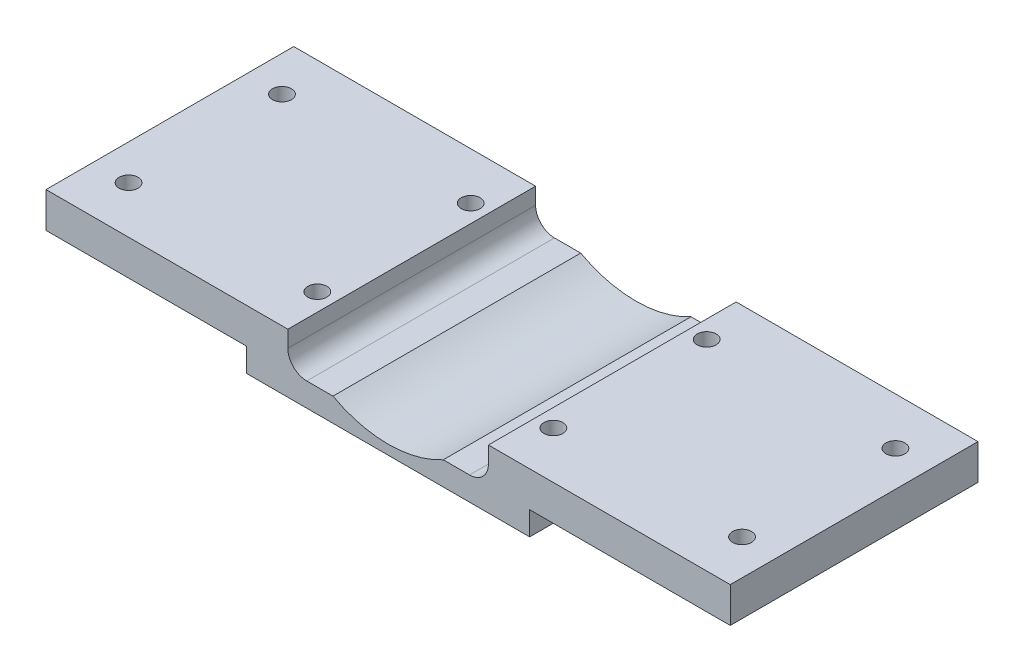
from build123d import *

# Parameters (mm, degrees)
SKETCH1_W              = 184.15
SKETCH1_H              = 66.675
BOSS_EXTRUDE1_DEPTH    = 9.525
SKETCH4_W              = 76.2
SKETCH4_H              = 6.35
BOSS_EXTRUDE2_DEPTH    = 66.675
SKETCH5_W              = 53.975
SKETCH5_H              = 66.675
CUT_EXTRUDE1_DEPTH     = 9.525
F_10_CLEARANCE_HOLE1_D = 5.1054
SKETCH12_R             = 31.019294643
CUT_EXTRUDE3_DEPTH     = 197.080350239
FILLET8_R              = 5.08
FILLET9_R              = 5.08


with BuildPart() as part:
    # Sketch1 → Boss-Extrude1 (new body)
    with BuildSketch(Plane(origin=(0, 0, 0), x_dir=(1, 0, 0), z_dir=(0, 1, 0))):
        with Locations((92.075, 33.3375)):
            Rectangle(SKETCH1_W, SKETCH1_H)
    extrude(amount=BOSS_EXTRUDE1_DEPTH)

    # Sketch4 → Boss-Extrude2 (add)
    with BuildSketch(Plane.XY):
        with Locations((92.075, -3.175)):
            Rectangle(SKETCH4_W, SKETCH4_H)
    extrude(amount=-BOSS_EXTRUDE2_DEPTH)

    # Sketch5 → Cut-Extrude1 (cut)
    with BuildSketch(Plane(origin=(0, 9.525, 0), x_dir=(1, 0, 0), z_dir=(0, 1, 0))):
        with Locations((92.075, 33.3375)):
            Rectangle(SKETCH5_W, SKETCH5_H)
    extrude(amount=-CUT_EXTRUDE1_DEPTH, mode=Mode.SUBTRACT)

    # #10 Clearance Hole1 (through all)
    with Locations(Plane(origin=(0, 9.525, 0), x_dir=(1, 0, 0), z_dir=(0, 1, 0))):
        with Locations((9.525, 53.975), (9.525, 12.7), (60.325, 12.7), (60.325, 53.975), (123.825, 53.975), (123.849810746, 12.7), (174.625, 12.7), (174.625, 53.975)):
            Hole(F_10_CLEARANCE_HOLE1_D / 2)

    # Sketch12 → Cut-Extrude3 (cut, through all)
    with BuildSketch(Plane(origin=(0, 0, -66.675), x_dir=(-1, 0, 0), z_dir=(0, 0, -1))):
        with Locations((-92.075, 27.239371317)):
            Circle(SKETCH12_R)
    extrude(amount=-CUT_EXTRUDE3_DEPTH, mode=Mode.SUBTRACT)

    # Fillet8
    fillet8_edges = [part.edges().sort_by_distance(p)[0] for p in [
        (65.0875, 0, -33.3375),
    ]]
    fillet(fillet8_edges, radius=FILLET8_R)

    # Fillet9
    fillet9_edges = [part.edges().sort_by_distance(p)[0] for p in [
        (119.0625, 0, -33.3375),
    ]]
    fillet(fillet9_edges, radius=FILLET9_R)


solid = part.part
